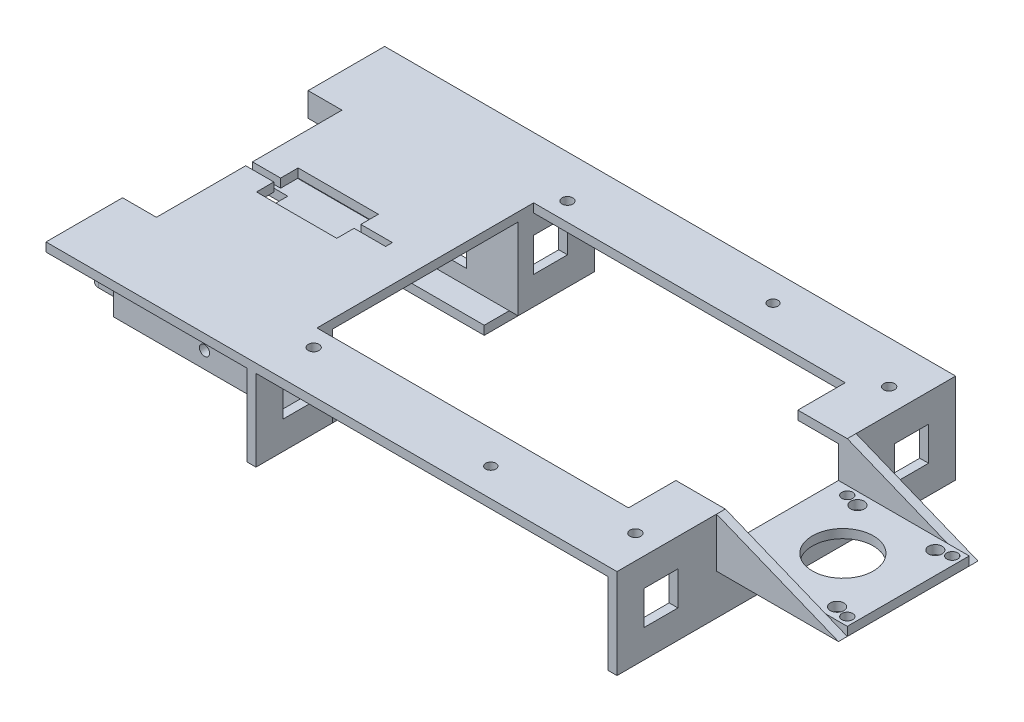
from build123d import *

# Parameters (mm, degrees)
EXTRUDE_1_DEPTH                  = 2.6
SKETCH_2_W                       = 100
SKETCH_2_H                       = 24
EXTRUDE_2_DEPTH                  = 2.6
SKETCH_4_W                       = 100
SKETCH_4_H                       = 24
EXTRUDE_3_DEPTH                  = 2.6
SKETCH_5_W                       = 62
SKETCH_5_H                       = 100
EXTRUDE_5_DEPTH                  = 2.6
SKETCH_7_W                       = 62
SKETCH_7_H                       = 100
EXTRUDE_6_DEPTH                  = 2.6
SKETCH_8_W                       = 59.4
SKETCH_8_H                       = 60
CUT_EXTRUDE_1_DEPTH              = 2.6
SKETCH_9_W                       = 59.4
SKETCH_9_H                       = 60
CUT_EXTRUDE_2_DEPTH              = 2.6
SKETCH_11_W                      = 59.4
SKETCH_11_H                      = 26.6
EXTRUDE_7_DEPTH                  = 2.6
SKETCH_12_W                      = 59.4
SKETCH_12_H                      = 26.6
EXTRUDE_8_DEPTH                  = 2.6
SKETCH_14_W                      = 59.4
SKETCH_14_H                      = 26.6
EXTRUDE_9_DEPTH                  = 2.6
SKETCH_15_W                      = 59.4
SKETCH_15_H                      = 26.6
EXTRUDE_10_DEPTH                 = 2.6
SKETCH_16_R                      = 1.6
CUT_EXTRUDE_3_DEPTH              = 127.775391934
SKETCH_17_W                      = 80
SKETCH_17_H                      = 64
CUT_EXTRUDE_4_DEPTH              = 127.775391934
SKETCH_21_W                      = 59.4
SKETCH_21_H                      = 54.8
EXTRUDE_11_DEPTH                 = 2.6
SKETCH_22_R                      = 1.6
CUT_EXTRUDE_5_DEPTH              = 2.6
SKETCH_23_W                      = 59.4
SKETCH_23_H                      = 54.8
EXTRUDE_13_DEPTH                 = 2.6
CUT_EXTRUDE_8_DEPTH              = 2.6
SKETCH_25_W                      = 54.8
SKETCH_25_H                      = 21.4
CUT_EXTRUDE_9_DEPTH              = 2.6
CUT_EXTRUDE_11_REACH             = 143.787
SKETCH_28_R                      = 1.5
CUT_EXTRUDE_11_DIRECTION_2_DEPTH = 142.787023384
SKETCH_31_W                      = 41.995824489
SKETCH_31_H                      = 54.8
CUT_EXTRUDE_14_DEPTH             = 2.6
SKETCH_32_W                      = 59.4
SKETCH_32_H                      = 24
CUT_EXTRUDE_15_DEPTH             = 70.6
SKETCH_33_W                      = 104
SKETCH_33_H                      = 100
CUT_EXTRUDE_16_DEPTH             = 2.6
SKETCH_34_W                      = 104
SKETCH_34_H                      = 99.672593916
EXTRUDE_14_DEPTH                 = 2.6
SKETCH_35_R                      = 1.6
CUT_EXTRUDE_24_DEPTH             = 2.6
SKETCH_36_W                      = 59.4
SKETCH_36_H                      = 100
CUT_EXTRUDE_25_DEPTH             = 2.6
SKETCH_37_W                      = 36
SKETCH_37_H                      = 2.6
EXTRUDE_17_DEPTH                 = 36
SKETCH_41_W                      = 36
SKETCH_41_H                      = 12
CUT_EXTRUDE_27_DEPTH             = 2.6
SKETCH_42_R                      = 1.6
CUT_EXTRUDE_28_DEPTH             = 2.6
SKETCH_43_R                      = 2
CUT_EXTRUDE_29_DEPTH             = 2.6
SKETCH_44_W                      = 104
SKETCH_44_H                      = 99.672593916
EXTRUDE_18_DEPTH                 = 2.6
SKETCH_45_R                      = 1.6
CUT_EXTRUDE_30_DEPTH             = 2.6
SKETCH_46_W                      = 80
SKETCH_46_H                      = 64
CUT_EXTRUDE_31_DEPTH             = 2.6
SKETCH_47_W                      = 40
SKETCH_47_H                      = 30
CUT_EXTRUDE_32_DEPTH             = 2.6
SKETCH_48_W                      = 12
SKETCH_48_H                      = 64
CUT_EXTRUDE_33_DEPTH             = 2.6
SKETCH_49_W                      = 40
SKETCH_49_H                      = 20
CUT_EXTRUDE_34_DEPTH             = 2.6
SKETCH_50_W                      = 39.937786469
SKETCH_50_H                      = 20
CUT_EXTRUDE_35_DEPTH             = 2.6
SKETCH_51_R                      = 9
CUT_EXTRUDE_36_DEPTH             = 2.6
CUT_EXTRUDE_38_REACH             = 143.787
SKETCH_52_W                      = 15
SKETCH_52_H                      = 15
SKETCH_55_W                      = 36
SKETCH_55_H                      = 2.6
CUT_EXTRUDE_39_DEPTH             = 12
CUT_EXTRUDE_START                = -109.2
SKETCH_56_W                      = 10
SKETCH_56_H                      = 10
CUT_EXTRUDE_40_DEPTH             = 109.2
CUT_EXTRUDE_41_REACH             = 129.293
SKETCH_57_R                      = 1.5
SKETCH_58_W                      = 104
SKETCH_58_H                      = 2.6
EXTRUDE_19_DEPTH                 = 0.327406084
SKETCH_59_W                      = 109.2
SKETCH_59_H                      = 100
CUT_EXTRUDE_42_DEPTH             = 2.6
SKETCH_60_W                      = 6.8
SKETCH_60_H                      = 15
CUT_EXTRUDE_43_DEPTH             = 1000
EXTRUDE_20_DEPTH                 = 2.6
EXTRUDE_21_DEPTH                 = 2.6
SKETCH_63_R                      = 1.6
EXTRUDE_22_DEPTH                 = 2.6
SKETCH_64_R                      = 1.6
EXTRUDE_23_DEPTH                 = 2.6
SKETCH_65_W                      = 1
SKETCH_65_H                      = 12.29143232
CUT_EXTRUDE_44_DEPTH             = 2.6
SKETCH_66_W                      = 2.6
SKETCH_66_H                      = 22.6
SKETCH_66_H_2                    = 100
EXTRUDE_24_DEPTH                 = 2.6
SKETCH_68_W                      = 59.4
SKETCH_68_H                      = 2.601943943
SKETCH_68_H_2                    = 2.6
EXTRUDE_26_DEPTH                 = 2.6
SKETCH_69_R                      = 1.5
EXTRUDE_28_DEPTH                 = 2.6
CUT_EXTRUDE_45_REACH             = 151.945
SKETCH_70_R                      = 1.5
EXTRUDE_29_DEPTH                 = 2.6
SKETCH_73_W                      = 59.4
SKETCH_73_H                      = 2.6
EXTRUDE_30_DEPTH                 = 54.798056057
SKETCH_74_W                      = 39.395824489
SKETCH_74_H                      = 40
CUT_EXTRUDE_46_DEPTH             = 2.6


with BuildPart() as part:
    # 草图1 → 凸台-拉伸1 (new body)
    with BuildSketch(Plane(origin=(0, 0, 0), x_dir=(1, 0, 0), z_dir=(0, 1, 0))):
        Polygon((52, 50), (0, 50), (-52, 50), (-52, -50), (52, -50), align=None)
    extrude(amount=EXTRUDE_1_DEPTH)

    # 草图2 → 凸台-拉伸2 (add)
    with BuildSketch(Plane.ZY.offset(52)):
        with Locations((0, 12)):
            Rectangle(SKETCH_2_W, SKETCH_2_H)
    extrude(amount=EXTRUDE_2_DEPTH)

    # 草图4 → 凸台-拉伸3 (add)
    with BuildSketch(Plane(origin=(52, 0, 0), x_dir=(0, 0, -1), z_dir=(1, 0, 0))):
        with Locations((0, 12)):
            Rectangle(SKETCH_4_W, SKETCH_4_H)
    extrude(amount=EXTRUDE_3_DEPTH)

    # 草图5 → 凸台-拉伸5 (add)
    with BuildSketch(Plane(origin=(0, 24, 0), x_dir=(1, 0, 0), z_dir=(0, 1, 0))):
        with Locations((-83, 0)):
            Rectangle(SKETCH_5_W, SKETCH_5_H)
    extrude(amount=EXTRUDE_5_DEPTH)

    # 草图7 → 凸台-拉伸6 (add)
    with BuildSketch(Plane(origin=(0, 24, 0), x_dir=(1, 0, 0), z_dir=(0, 1, 0))):
        with Locations((83, 0)):
            Rectangle(SKETCH_7_W, SKETCH_7_H)
    extrude(amount=EXTRUDE_6_DEPTH)

    # 草图8 → 切除-拉伸1 (cut)
    with BuildSketch(Plane(origin=(0, 24, 0), x_dir=(1, 0, 0), z_dir=(0, 1, 0))):
        with Locations((-84.3, 0)):
            Rectangle(SKETCH_8_W, SKETCH_8_H)
    extrude(amount=CUT_EXTRUDE_1_DEPTH, mode=Mode.SUBTRACT)

    # 草图9 → 切除-拉伸2 (cut)
    with BuildSketch(Plane.XZ.offset(-24)):
        with Locations((84.3, 0)):
            Rectangle(SKETCH_9_W, SKETCH_9_H)
    extrude(amount=-CUT_EXTRUDE_2_DEPTH, mode=Mode.SUBTRACT)

    # 草图11 → 凸台-拉伸7 (add)
    with BuildSketch(Plane(origin=(0, 0, 30), x_dir=(-1, 0, 0), z_dir=(0, 0, -1))):
        with Locations((-84.3, 13.3)):
            Rectangle(SKETCH_11_W, SKETCH_11_H)
    extrude(amount=EXTRUDE_7_DEPTH)

    # 草图12 → 凸台-拉伸8 (add)
    with BuildSketch(Plane.XY.offset(-30)):
        with Locations((84.3, 13.3)):
            Rectangle(SKETCH_12_W, SKETCH_12_H)
    extrude(amount=EXTRUDE_8_DEPTH)

    # 草图14 → 凸台-拉伸9 (add)
    with BuildSketch(Plane.XY.offset(-30)):
        with Locations((-84.3, 13.3)):
            Rectangle(SKETCH_14_W, SKETCH_14_H)
    extrude(amount=EXTRUDE_9_DEPTH)

    # 草图15 → 凸台-拉伸10 (add)
    with BuildSketch(Plane(origin=(0, 0, 30), x_dir=(-1, 0, 0), z_dir=(0, 0, -1))):
        with Locations((84.3, 13.3)):
            Rectangle(SKETCH_15_W, SKETCH_15_H)
    extrude(amount=EXTRUDE_10_DEPTH)

    # 草图16 → 切除-拉伸3 (cut, through all)
    with BuildSketch(Plane(origin=(0, 2.6, 0), x_dir=(1, 0, 0), z_dir=(0, 1, 0))):
        with Locations(Location((-47.5, 37.465, 0), (0, 0, 270))):
            Circle(SKETCH_16_R)
        with Locations(Location((47.5, 37.465, 0), (0, 0, 90))):
            Circle(SKETCH_16_R)
        with Locations(Location((-47.5, -37.465, 0), (0, 0, 90))):
            Circle(SKETCH_16_R)
        with Locations(Location((47.5, -37.465, 0), (0, 0, 270))):
            Circle(SKETCH_16_R)
    extrude(amount=-CUT_EXTRUDE_3_DEPTH, mode=Mode.SUBTRACT)

    # 草图17 → 切除-拉伸4 (cut, through all)
    with BuildSketch(Plane(origin=(0, 2.6, 0), x_dir=(1, 0, 0), z_dir=(0, 1, 0))):
        Rectangle(SKETCH_17_W, SKETCH_17_H)
    extrude(amount=-CUT_EXTRUDE_4_DEPTH, mode=Mode.SUBTRACT)

    # 草图21 → 凸台-拉伸11 (add)
    with BuildSketch(Plane.XZ):
        with Locations((-84.3, 0)):
            Rectangle(SKETCH_21_W, SKETCH_21_H)
    extrude(amount=-EXTRUDE_11_DEPTH)

    # 草图22 → 切除-拉伸5 (cut)
    with BuildSketch(Plane(origin=(0, 2.6, 0), x_dir=(1, 0, 0), z_dir=(0, 1, 0))):
        with Locations(Location((-109, 18, 0), (0, 0, 270))):
            Circle(SKETCH_22_R)
        with Locations(Location((-109, 0, 0), (0, 0, 270))):
            Circle(SKETCH_22_R)
        with Locations(Location((-109, -18, 0), (0, 0, 90))):
            Circle(SKETCH_22_R)
    extrude(amount=-CUT_EXTRUDE_5_DEPTH, mode=Mode.SUBTRACT)

    # 草图23 → 凸台-拉伸13 (add)
    with BuildSketch(Plane(origin=(0, 26.6, 0), x_dir=(1, 0, 0), z_dir=(0, 1, 0))):
        with Locations((-84.3, 0)):
            Rectangle(SKETCH_23_W, SKETCH_23_H)
    extrude(amount=-EXTRUDE_13_DEPTH)

    # 草图24 → 切除-拉伸8 (cut)
    with BuildSketch(Plane(origin=(0, 26.6, 0), x_dir=(1, 0, 0), z_dir=(0, 1, 0))):
        Polygon((-114, 27.4), (-104, 27.4), (-104, 0.9702404), (-94.7, 0.9702404), (-94.7, 6.15), (-72, 6.15), (-72, 0.9702404), (-62.7, 0.9702404), (-62.7, -1.0297596), (-72, -1.0297596), (-72, -6.15), (-94.7, -6.15), (-94.7, -1.0297596), (-104, -1.0297596), (-104, -27.4), (-114, -27.4), align=None)
    extrude(amount=-CUT_EXTRUDE_8_DEPTH, mode=Mode.SUBTRACT)

    # 草图25 → 切除-拉伸9 (cut)
    with BuildSketch(Plane.ZY.offset(54.6)):
        with Locations((0, 13.3)):
            Rectangle(SKETCH_25_W, SKETCH_25_H)
    extrude(amount=-CUT_EXTRUDE_9_DEPTH, mode=Mode.SUBTRACT)

    # 切除-拉伸11: up to this face of the body (flat: up to its plane)
    cut_extrude_11_end = Plane(part.part.faces().sort_by_distance((-84.3, 12, -30))[0])
    # 草图28 → 切除-拉伸11 (cut, up to the picked face)
    with BuildSketch(Plane.XY.offset(30), mode=Mode.PRIVATE) as cut_extrude_11_sk1:
        with Locations(Location((-87.2, 20.75, 0), (0, 0, 180))):
            Circle(SKETCH_28_R)
    cut_extrude_11_tool1 = split(extrude(cut_extrude_11_sk1.sketch, amount=-CUT_EXTRUDE_11_REACH, mode=Mode.PRIVATE), bisect_by=cut_extrude_11_end, keep=Keep.BOTH, mode=Mode.PRIVATE)
    # 草图28 → 切除-拉伸11 (cut, up to the picked face)
    with BuildSketch(Plane.XY.offset(30), mode=Mode.PRIVATE) as cut_extrude_11_sk2:
        with Locations(Location((-87.2, 3.25, 0), (0, 0, 180))):
            Circle(SKETCH_28_R)
    cut_extrude_11_tool2 = split(extrude(cut_extrude_11_sk2.sketch, amount=-CUT_EXTRUDE_11_REACH, mode=Mode.PRIVATE), bisect_by=cut_extrude_11_end, keep=Keep.BOTH, mode=Mode.PRIVATE)
    add(cut_extrude_11_tool1.solids().sort_by(Axis((-87.2, 20.75, 30), (0, 0, -1)))[0], mode=Mode.SUBTRACT)
    add(cut_extrude_11_tool2.solids().sort_by(Axis((-87.2, 3.25, 30), (0, 0, -1)))[0], mode=Mode.SUBTRACT)

    # 草图28 → 切除-拉伸11 direction 2 (cut)
    with BuildSketch(Plane.XY.offset(30)):
        with Locations(Location((-87.2, 20.75, 0), (0, 0, 180))):
            Circle(SKETCH_28_R)
        with Locations(Location((-87.2, 3.25, 0), (0, 0, 180))):
            Circle(SKETCH_28_R)
    extrude(amount=CUT_EXTRUDE_11_DIRECTION_2_DEPTH, mode=Mode.SUBTRACT)

    # 草图31 → 切除-拉伸14 (cut)
    with BuildSketch(Plane(origin=(0, 2.6, 0), x_dir=(1, 0, 0), z_dir=(0, 1, 0))):
        with Locations((-72.997912245, 0)):
            Rectangle(SKETCH_31_W, SKETCH_31_H)
    extrude(amount=-CUT_EXTRUDE_14_DEPTH, mode=Mode.SUBTRACT)

    # 草图32 → 切除-拉伸15 (cut)
    with BuildSketch(Plane.XY.offset(30)):
        with Locations((84.3, 12)):
            Rectangle(SKETCH_32_W, SKETCH_32_H)
    extrude(amount=-CUT_EXTRUDE_15_DEPTH, mode=Mode.SUBTRACT)

    # 草图33 → 切除-拉伸16 (cut)
    with BuildSketch(Plane(origin=(0, 2.6, 0), x_dir=(1, 0, 0), z_dir=(0, 1, 0))):
        Rectangle(SKETCH_33_W, SKETCH_33_H)
    extrude(amount=-CUT_EXTRUDE_16_DEPTH, mode=Mode.SUBTRACT)


with BuildPart() as cut_extrude_16_piece_1:
    # of the separate pieces the step leaves, piece 1, a body of its own (cut_extrude_16_pieces)
    add(part.part.solids().sort_by_distance((-52, 0, -50))[0])



with BuildPart() as cut_extrude_16_piece_2:
    # of the separate pieces the step leaves, piece 2, a body of its own (cut_extrude_16_pieces)
    add(part.part.solids().sort_by_distance((114, 26.6, -50))[0])


with BuildPart() as cut_extrude_16_piece_1_1:
    add(cut_extrude_16_piece_1.part)

    add(cut_extrude_16_piece_2.part)  # 凸台-拉伸14 merges 切除-拉伸16 piece 2
    # 草图34 → 凸台-拉伸14 (add)
    with BuildSketch(Plane.XZ):
        with Locations((0, 0.163703042)):
            Rectangle(SKETCH_34_W, SKETCH_34_H)
    extrude(amount=-EXTRUDE_14_DEPTH)

    # 草图35 → 切除-拉伸24 (cut)
    with BuildSketch(Plane(origin=(0, 2.6, 0), x_dir=(1, 0, 0), z_dir=(0, 1, 0))):
        with Locations(Location((-39.5, 21.5, 0), (0, 0, 270))):
            Circle(SKETCH_35_R)
        with Locations(Location((9.5, 21.5, 0), (0, 0, 270))):
            Circle(SKETCH_35_R)
        with Locations(Location((9.5, -21.5, 0), (0, 0, 90))):
            Circle(SKETCH_35_R)
        with Locations(Location((-39.5, -21.5, 0), (0, 0, 90))):
            Circle(SKETCH_35_R)
    extrude(amount=-CUT_EXTRUDE_24_DEPTH, mode=Mode.SUBTRACT)

    # 草图36 → 切除-拉伸25 (cut)
    with BuildSketch(Plane(origin=(0, 26.6, 0), x_dir=(1, 0, 0), z_dir=(0, 1, 0))):
        with Locations((84.3, 0)):
            Rectangle(SKETCH_36_W, SKETCH_36_H)
    extrude(amount=-CUT_EXTRUDE_25_DEPTH, mode=Mode.SUBTRACT)

    # 草图37 → 凸台-拉伸17 (add)
    with BuildSketch(Plane(origin=(54.6, 0, 0), x_dir=(0, 0, -1), z_dir=(1, 0, 0))):
        with Locations((0, 13.3)):
            Rectangle(SKETCH_37_W, SKETCH_37_H)
    extrude(amount=EXTRUDE_17_DEPTH)

    # 草图41 → 切除-拉伸27 (cut)
    with BuildSketch(Plane(origin=(54.6, 0, 0), x_dir=(0, 0, -1), z_dir=(1, 0, 0))):
        with Locations((0, 20.6)):
            Rectangle(SKETCH_41_W, SKETCH_41_H)
    extrude(amount=-CUT_EXTRUDE_27_DEPTH, mode=Mode.SUBTRACT)

    # 草图42 → 切除-拉伸28 (cut)
    with BuildSketch(Plane(origin=(0, 14.6, 0), x_dir=(1, 0, 0), z_dir=(0, 1, 0))):
        with Locations(Location((88.1, 15.5, 0), (0, 0, 270))):
            Circle(SKETCH_42_R)
        with Locations(Location((88.1, -15.5, 0), (0, 0, 90))):
            Circle(SKETCH_42_R)
        with Locations(Location((57.1, 15.5, 0), (0, 0, 270))):
            Circle(SKETCH_42_R)
        with Locations(Location((57.1, -15.5, 0), (0, 0, 90))):
            Circle(SKETCH_42_R)
    extrude(amount=-CUT_EXTRUDE_28_DEPTH, mode=Mode.SUBTRACT)

    # 草图43 → 切除-拉伸29 (cut)
    with BuildSketch(Plane(origin=(0, 14.6, 0), x_dir=(1, 0, 0), z_dir=(0, 1, 0))):
        with Locations(Location((61.1, 14.5, 0), (0, 0, 270))):
            Circle(SKETCH_43_R)
        with Locations(Location((84.1, 14.5, 0), (0, 0, 270))):
            Circle(SKETCH_43_R)
        with Locations(Location((84.1, -14.5, 0), (0, 0, 90))):
            Circle(SKETCH_43_R)
        with Locations(Location((61.1, -14.5, 0), (0, 0, 90))):
            Circle(SKETCH_43_R)
    extrude(amount=-CUT_EXTRUDE_29_DEPTH, mode=Mode.SUBTRACT)

    # 草图44 → 凸台-拉伸18 (add)
    with BuildSketch(Plane(origin=(0, 26.6, 0), x_dir=(1, 0, 0), z_dir=(0, 1, 0))):
        with Locations((0, -0.163703042)):
            Rectangle(SKETCH_44_W, SKETCH_44_H)
    extrude(amount=-EXTRUDE_18_DEPTH)

    # 草图45 → 切除-拉伸30 (cut)
    with BuildSketch(Plane(origin=(0, 26.6, 0), x_dir=(1, 0, 0), z_dir=(0, 1, 0))):
        with Locations(Location((-47.5, -37.465, 0), (0, 0, 270))):
            Circle(SKETCH_45_R)
        with Locations(Location((-47.5, 37.465, 0), (0, 0, 90))):
            Circle(SKETCH_45_R)
        with Locations(Location((47.5, -37.465, 0), (0, 0, 90))):
            Circle(SKETCH_45_R)
        with Locations(Location((47.5, 37.465, 0), (0, 0, 270))):
            Circle(SKETCH_45_R)
    extrude(amount=-CUT_EXTRUDE_30_DEPTH, mode=Mode.SUBTRACT)

    # 草图46 → 切除-拉伸31 (cut)
    with BuildSketch(Plane(origin=(0, 26.6, 0), x_dir=(1, 0, 0), z_dir=(0, 1, 0))):
        Rectangle(SKETCH_46_W, SKETCH_46_H)
    extrude(amount=-CUT_EXTRUDE_31_DEPTH, mode=Mode.SUBTRACT)

    # 草图47 → 切除-拉伸32 (cut)
    with BuildSketch(Plane(origin=(0, 2.6, 0), x_dir=(1, 0, 0), z_dir=(0, 1, 0))):
        with Locations((-15, 0)):
            Rectangle(SKETCH_47_W, SKETCH_47_H)
    extrude(amount=-CUT_EXTRUDE_32_DEPTH, mode=Mode.SUBTRACT)

    # 草图48 → 切除-拉伸33 (cut)
    with BuildSketch(Plane(origin=(0, 26.6, 0), x_dir=(1, 0, 0), z_dir=(0, 1, 0))):
        with Locations((-46, 0)):
            Rectangle(SKETCH_48_W, SKETCH_48_H)
    extrude(amount=-CUT_EXTRUDE_33_DEPTH, mode=Mode.SUBTRACT)

    # 草图49 → 切除-拉伸34 (cut)
    with BuildSketch(Plane(origin=(0, 2.6, 0), x_dir=(1, 0, 0), z_dir=(0, 1, 0))):
        with Locations((-15, -25)):
            Rectangle(SKETCH_49_W, SKETCH_49_H)
    extrude(amount=-CUT_EXTRUDE_34_DEPTH, mode=Mode.SUBTRACT)

    # 草图50 → 切除-拉伸35 (cut)
    with BuildSketch(Plane(origin=(0, 2.6, 0), x_dir=(1, 0, 0), z_dir=(0, 1, 0))):
        with Locations((-15.031106765, 25)):
            Rectangle(SKETCH_50_W, SKETCH_50_H)
    extrude(amount=-CUT_EXTRUDE_35_DEPTH, mode=Mode.SUBTRACT)

    # 草图51 → 切除-拉伸36 (cut)
    with BuildSketch(Plane(origin=(0, 14.6, 0), x_dir=(1, 0, 0), z_dir=(0, 1, 0))):
        with Locations(Location((71.3, 0, 0), (0, 0, 270))):
            Circle(SKETCH_51_R)
    extrude(amount=-CUT_EXTRUDE_36_DEPTH, mode=Mode.SUBTRACT)

    # 切除-拉伸38: up to this face of the body (flat: up to its plane)
    cut_extrude_38_end = Plane(cut_extrude_16_piece_1_1.part.faces().sort_by_distance((-84.270953692, 12, -30))[0])
    # 草图52 → 切除-拉伸38 (cut, up to the picked face)
    with BuildSketch(Plane.XY.offset(30), mode=Mode.PRIVATE) as cut_extrude_38_sk1:
        with Locations((-74.7, 12)):
            Rectangle(SKETCH_52_W, SKETCH_52_H)
    cut_extrude_38_tool1 = split(extrude(cut_extrude_38_sk1.sketch, amount=-CUT_EXTRUDE_38_REACH, mode=Mode.PRIVATE), bisect_by=cut_extrude_38_end, keep=Keep.BOTH, mode=Mode.PRIVATE)
    # 草图52 → 切除-拉伸38 (cut, up to the picked face)
    with BuildSketch(Plane.XY.offset(30), mode=Mode.PRIVATE) as cut_extrude_38_sk2:
        with Locations((-99.7, 12)):
            Rectangle(SKETCH_52_W, SKETCH_52_H)
    cut_extrude_38_tool2 = split(extrude(cut_extrude_38_sk2.sketch, amount=-CUT_EXTRUDE_38_REACH, mode=Mode.PRIVATE), bisect_by=cut_extrude_38_end, keep=Keep.BOTH, mode=Mode.PRIVATE)
    add(cut_extrude_38_tool1.solids().sort_by(Axis((-74.7, 12, 30), (0, 0, -1)))[0], mode=Mode.SUBTRACT)
    add(cut_extrude_38_tool2.solids().sort_by(Axis((-99.7, 12, 30), (0, 0, -1)))[0], mode=Mode.SUBTRACT)

    # 草图55 → 切除-拉伸39 (cut)
    with BuildSketch(Plane(origin=(52, 0, 0), x_dir=(0, 0, -1), z_dir=(1, 0, 0))):
        with Locations((0, 25.3)):
            Rectangle(SKETCH_55_W, SKETCH_55_H)
    extrude(amount=-CUT_EXTRUDE_39_DEPTH, mode=Mode.SUBTRACT)

    # 草图56 → 切除-拉伸40 (cut)
    with BuildSketch(Plane(origin=(54.6, 0, 0), x_dir=(0, 0, -1), z_dir=(1, 0, 0)).offset(CUT_EXTRUDE_START)):
        with Locations((-37, 13.3)):
            Rectangle(SKETCH_56_W, SKETCH_56_H)
        with Locations((37, 13.3)):
            Rectangle(SKETCH_56_W, SKETCH_56_H)
    extrude(amount=CUT_EXTRUDE_40_DEPTH, mode=Mode.SUBTRACT)

    # 切除-拉伸41: up to this face of the body (flat: up to its plane)
    cut_extrude_41_end = Plane(cut_extrude_16_piece_1_1.part.faces().sort_by_distance((52.639745935, 26.6, -34))[0])
    # 草图57 → 切除-拉伸41 (cut, up to the picked face)
    with BuildSketch(Plane.XZ, mode=Mode.PRIVATE) as cut_extrude_41_sk1:
        with Locations(Location((9, -41.672593916, 0), (0, 0, 270))):
            Circle(SKETCH_57_R)
    cut_extrude_41_tool1 = split(extrude(cut_extrude_41_sk1.sketch, amount=-CUT_EXTRUDE_41_REACH, mode=Mode.PRIVATE), bisect_by=cut_extrude_41_end, keep=Keep.BOTH, mode=Mode.PRIVATE)
    # 草图57 → 切除-拉伸41 (cut, up to the picked face)
    with BuildSketch(Plane.XZ, mode=Mode.PRIVATE) as cut_extrude_41_sk2:
        with Locations(Location((9, 41.672593916, 0), (0, 0, 270))):
            Circle(SKETCH_57_R)
    cut_extrude_41_tool2 = split(extrude(cut_extrude_41_sk2.sketch, amount=-CUT_EXTRUDE_41_REACH, mode=Mode.PRIVATE), bisect_by=cut_extrude_41_end, keep=Keep.BOTH, mode=Mode.PRIVATE)
    add(cut_extrude_41_tool1.solids().sort_by(Axis((9, 0, -41.672594), (0, 1, 0)))[0], mode=Mode.SUBTRACT)
    add(cut_extrude_41_tool2.solids().sort_by(Axis((9, 0, 41.672594), (0, 1, 0)))[0], mode=Mode.SUBTRACT)

    # 草图58 → 凸台-拉伸19 (add)
    with BuildSketch(Plane(origin=(0, 0, -49.672593916), x_dir=(-1, 0, 0), z_dir=(0, 0, -1))):
        with Locations((0, 25.3)):
            Rectangle(SKETCH_58_W, SKETCH_58_H)
        with Locations((0, 1.3)):
            Rectangle(SKETCH_58_W, SKETCH_58_H)
    extrude(amount=EXTRUDE_19_DEPTH)

    # 草图59 → 切除-拉伸42 (cut)
    with BuildSketch(Plane.XZ):
        Rectangle(SKETCH_59_W, SKETCH_59_H)
    extrude(amount=-CUT_EXTRUDE_42_DEPTH, mode=Mode.SUBTRACT)

    # 草图60 → 切除-拉伸43 (cut)
    with BuildSketch(Plane(origin=(0, 0, -30), x_dir=(-1, 0, 0), z_dir=(0, 0, -1))):
        with Locations((110.6, 12)):
            Rectangle(SKETCH_60_W, SKETCH_60_H)
    extrude(amount=-CUT_EXTRUDE_43_DEPTH, mode=Mode.SUBTRACT)

    # 草图61 → 凸台-拉伸20 (add)
    with BuildSketch(Plane(origin=(0, 0, -18), x_dir=(-1, 0, 0), z_dir=(0, 0, -1))):
        Polygon((-54.6, 12), (-90.6, 12), (-54.6, 26.6), align=None)
    extrude(amount=EXTRUDE_20_DEPTH)

    # 草图62 → 凸台-拉伸21 (add)
    with BuildSketch(Plane.XY.offset(18)):
        Polygon((54.6, 26.6), (54.6, 12), (90.6, 12), align=None)
    extrude(amount=EXTRUDE_21_DEPTH)

    # 草图63 → 凸台-拉伸22 (add)
    with BuildSketch(Plane(origin=(0, 2.6, 0), x_dir=(1, 0, 0), z_dir=(0, 1, 0))):
        with Locations((-109, 18)):
            Circle(SKETCH_63_R)
        with Locations((-109, 0)):
            Circle(SKETCH_63_R)
        with Locations((-109, -18)):
            Circle(SKETCH_63_R)
    extrude(amount=-EXTRUDE_22_DEPTH)

    # 草图64 → 凸台-拉伸23 (add)
    # profile 1 of 3: a face of its own
    with BuildSketch(Plane(origin=(0, 2.6, 0), x_dir=(1, 0, 0), z_dir=(0, 1, 0))):
        with BuildLine():
            Line((-114, 21.4), (-114, 27.4))
            Line((-114, 27.4), (-121, 27.4))
            ThreePointArc((-121, 27.4), (-124, 24.4), (-121, 21.4))
            Line((-121, 21.4), (-114, 21.4))
        make_face()
        with Locations(Location((-121, 24.4, 0), (0, 0, 270))):
            Circle(SKETCH_64_R, mode=Mode.SUBTRACT)
    # profile 2 of 3: a face of its own
    with BuildSketch(Plane(origin=(0, 2.6, 0), x_dir=(1, 0, 0), z_dir=(0, 1, 0))):
        with BuildLine():
            Line((-114, -3), (-114, 3))
            Line((-114, 3), (-121, 3))
            ThreePointArc((-121, 3), (-124, 0), (-121, -3))
            Line((-121, -3), (-114, -3))
        make_face()
        with Locations(Location((-121, 0, 0), (0, 0, 270))):
            Circle(SKETCH_64_R, mode=Mode.SUBTRACT)
    # profile 3 of 3: a face of its own
    with BuildSketch(Plane(origin=(0, 2.6, 0), x_dir=(1, 0, 0), z_dir=(0, 1, 0))):
        with BuildLine():
            Line((-114, -27.398056057), (-114, -21.4))
            Line((-114, -21.4), (-121, -21.4))
            ThreePointArc((-121, -21.4), (-123.999513975, -24.346000785), (-121.107980933, -27.398056057))
            Line((-121.107980933, -27.398056057), (-120.892019067, -27.398056057))
            Line((-120.892019067, -27.398056057), (-114, -27.398056057))
        make_face()
        with Locations(Location((-121, -24.4, 0), (0, 0, 270))):
            Circle(SKETCH_64_R, mode=Mode.SUBTRACT)
    extrude(amount=-EXTRUDE_23_DEPTH)

    # 草图65 → 切除-拉伸44 (cut)
    with BuildSketch(Plane(origin=(0, 26.6, 0), x_dir=(1, 0, 0), z_dir=(0, 1, 0))):
        with Locations((-95.2, 0.00428384)):
            Rectangle(SKETCH_65_W, SKETCH_65_H)
    extrude(amount=-CUT_EXTRUDE_44_DEPTH, mode=Mode.SUBTRACT)

    # 草图66 → 凸台-拉伸24 (add)
    with BuildSketch(Plane.XZ.offset(-2.6)):
        with Locations((-53.3, 38.7)):
            Rectangle(SKETCH_66_W, SKETCH_66_H)
        with Locations((-53.3, -38.7)):
            Rectangle(SKETCH_66_W, SKETCH_66_H)
        with Locations((53.3, 0)):
            Rectangle(SKETCH_66_W, SKETCH_66_H_2)
    extrude(amount=EXTRUDE_24_DEPTH)

    # 草图68 → 凸台-拉伸26 (add)
    with BuildSketch(Plane.XZ):
        with Locations((-84.3, 28.699028029)):
            Rectangle(SKETCH_68_W, SKETCH_68_H)
        with Locations((-84.3, -28.7)):
            Rectangle(SKETCH_68_W, SKETCH_68_H_2)
    extrude(amount=EXTRUDE_26_DEPTH)

    # 草图69 → 凸台-拉伸28 (add)
    with BuildSketch(Plane.XY.offset(30)):
        with Locations(Location((-87.2, 3.25, 0), (0, 0, 180))):
            Circle(SKETCH_69_R)
        with Locations(Location((-87.2, 20.75, 0), (0, 0, 180))):
            Circle(SKETCH_69_R)
    extrude(amount=-EXTRUDE_28_DEPTH)

    # 切除-拉伸45: up to this face of the body (flat: up to its plane)
    cut_extrude_45_end = Plane(cut_extrude_16_piece_1_1.part.faces().sort_by_distance((-55.250839458, 12, 30))[0])
    # 草图70 → 切除-拉伸45 (cut, up to the picked face)
    with BuildSketch(Plane(origin=(0, 0, -30), x_dir=(-1, 0, 0), z_dir=(0, 0, -1)), mode=Mode.PRIVATE) as cut_extrude_45_sk1:
        with Locations((87.2, 19.75)):
            Circle(SKETCH_70_R)
    cut_extrude_45_tool1 = split(extrude(cut_extrude_45_sk1.sketch, amount=-CUT_EXTRUDE_45_REACH, mode=Mode.PRIVATE), bisect_by=cut_extrude_45_end, keep=Keep.BOTH, mode=Mode.PRIVATE)
    # 草图70 → 切除-拉伸45 (cut, up to the picked face)
    with BuildSketch(Plane(origin=(0, 0, -30), x_dir=(-1, 0, 0), z_dir=(0, 0, -1)), mode=Mode.PRIVATE) as cut_extrude_45_sk2:
        with Locations((87.2, 2.25)):
            Circle(SKETCH_70_R)
    cut_extrude_45_tool2 = split(extrude(cut_extrude_45_sk2.sketch, amount=-CUT_EXTRUDE_45_REACH, mode=Mode.PRIVATE), bisect_by=cut_extrude_45_end, keep=Keep.BOTH, mode=Mode.PRIVATE)
    add(cut_extrude_45_tool1.solids().sort_by(Axis((-87.2, 19.75, -30), (0, 0, 1)))[0], mode=Mode.SUBTRACT)
    add(cut_extrude_45_tool2.solids().sort_by(Axis((-87.2, 2.25, -30), (0, 0, 1)))[0], mode=Mode.SUBTRACT)

    # 草图71 → 凸台-拉伸29 (add)
    with BuildSketch(Plane(origin=(0, 0, -30), x_dir=(-1, 0, 0), z_dir=(0, 0, -1))):
        with BuildLine():
            ThreePointArc((88.614213562, 20.25), (87.2, 22.25), (85.785786438, 20.25))
            ThreePointArc((85.785786438, 20.25), (87.2, 21.25), (88.614213562, 20.25))
        make_face()
        with BuildLine():
            ThreePointArc((88.614213562, 2.75), (87.2, 3.75), (85.785786438, 2.75))
            ThreePointArc((85.785786438, 2.75), (87.2, 4.75), (88.614213562, 2.75))
        make_face()
    extrude(amount=-EXTRUDE_29_DEPTH)

    # 草图73 → 凸台-拉伸30 (add)
    with BuildSketch(Plane(origin=(0, 0, 27.398056057), x_dir=(-1, 0, 0), z_dir=(0, 0, -1))):
        with Locations((84.3, -1.3)):
            Rectangle(SKETCH_73_W, SKETCH_73_H)
    extrude(amount=EXTRUDE_30_DEPTH)

    # 草图74 → 切除-拉伸46 (cut)
    with BuildSketch(Plane.XZ.offset(2.6)):
        with Locations((-74.297912244, 0)):
            Rectangle(SKETCH_74_W, SKETCH_74_H)
    extrude(amount=-CUT_EXTRUDE_46_DEPTH, mode=Mode.SUBTRACT)


solid = cut_extrude_16_piece_1_1.part
